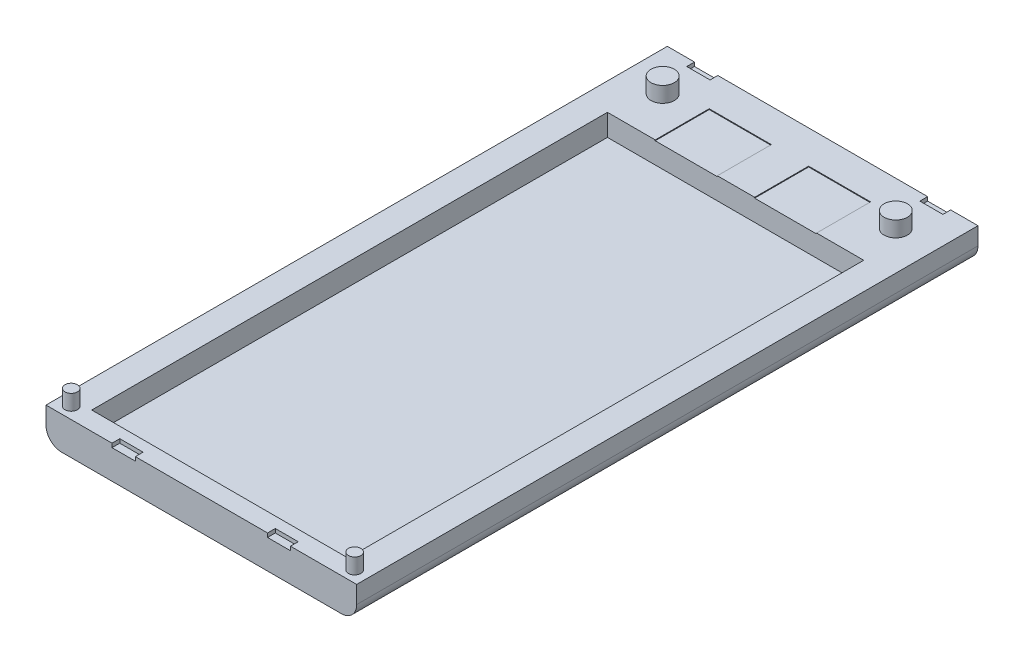
from build123d import *

# Parameters (mm, degrees)
SKETCH2_W           = 40
SKETCH2_H           = 80
BOSS_EXTRUDE2_DEPTH = 4.25
CUT_EXTRUDE3_DEPTH  = 2.8
CUT_EXTRUDE4_DEPTH  = 0.1
F_3DSKETCH4_R       = 1.5
BOSS_EXTRUDE3_DEPTH = 2
F_3DSKETCH5_R       = 0.8
BOSS_EXTRUDE4_DEPTH = 2
FILLET1_R           = 2
CUT_EXTRUDE5_DEPTH  = 1
SKETCH4_W           = 2.963043318
SKETCH4_H           = 0.5
SKETCH4_W_2         = 2.99871765
CUT_EXTRUDE6_DEPTH  = 1
SKETCH5_W           = 0.284935898
SKETCH5_H           = 3.256410256
SKETCH5_W_2         = 0.284935897
CUT_EXTRUDE7_DEPTH  = 0.5


with BuildPart() as part:
    # Sketch2 → Boss-Extrude2 (new body)
    with BuildSketch(Plane(origin=(0, 0, 0), x_dir=(1, 0, 0), z_dir=(0, 1, 0))):
        Rectangle(SKETCH2_W, SKETCH2_H)
    extrude(amount=BOSS_EXTRUDE2_DEPTH)

    # 3DSketch2 → Cut-Extrude3 (cut)
    with BuildSketch(Plane(origin=(-16.5, 4.25, 37.611644857), x_dir=(0.4450544542521407, 0, -0.8955035079497619), z_dir=(0, -1, 0))):
        Polygon((0, 0), (59.461432928, -29.551615762), (74.148229918, 0), (14.68679699, 29.551615762), align=None)
    extrude(amount=CUT_EXTRUDE3_DEPTH, mode=Mode.SUBTRACT)

    # 3DSketch3 → Cut-Extrude4 (cut)
    with BuildSketch(Plane(origin=(-2.347777477, 4.25, -28.788355143), x_dir=(0.8783770933066173, 0, -0.47796828551088866), z_dir=(0, 1, 0))):
        Polygon((0, 0), (-7.027782324, 3.824162873), (-3.705260259, 9.930064377), (3.322522065, 6.105901505), align=None)
        Polygon((4.216210048, -2.29424777), (11.221003942, -6.105901505), (14.543526007, 0), (7.538732113, 3.811653734), align=None)
    extrude(amount=-CUT_EXTRUDE4_DEPTH, mode=Mode.SUBTRACT)

    # 3DSketch4 → Boss-Extrude3 (add)
    with BuildSketch(Plane(origin=(-15, 4.25, -34.4), x_dir=(1, 0, 0), z_dir=(0, -1, 0))):
        with Locations(Location((0, 0, 0), (0, 0, 90))):
            Circle(F_3DSKETCH4_R)
        with Locations(Location((30.012966491, 0, 0), (0, 0, 90))):
            Circle(F_3DSKETCH4_R)
    extrude(amount=-BOSS_EXTRUDE3_DEPTH)

    # 3DSketch5 → Boss-Extrude4 (add)
    with BuildSketch(Plane(origin=(-18.25, 4.25, 38.508038117), x_dir=(1, 0, 0), z_dir=(0, -1, 0))):
        with Locations(Location((0, 0, 0), (0, 0, 90))):
            Circle(F_3DSKETCH5_R)
        with Locations(Location((36.500375839, 0, 0), (0, 0, 90))):
            Circle(F_3DSKETCH5_R)
    extrude(amount=-BOSS_EXTRUDE4_DEPTH)

    # Fillet1
    fillet1_edges = [part.edges().sort_by_distance(p)[0] for p in [
        (-20, 0, 0),
        (20, 0, 0),
    ]]
    fillet(fillet1_edges, radius=FILLET1_R)

    # 3DSketch6 → Cut-Extrude5 (cut)
    with BuildSketch(Plane(origin=(-11.502928921, 3.74686041, 40), x_dir=(0.9997603843672082, 0.021890039971004784, 0), z_dir=(0, 0, 1))):
        Polygon((0, 0), (3.005137591, -0.065798348), (3.016151337, 0.437220682), (0.011013746, 0.50301903), align=None)
        Polygon((20.021702774, -0.438380917), (22.973850192, -0.50301903), (22.984863938, 0), (20.032716519, 0.064638113), align=None)
    extrude(amount=-CUT_EXTRUDE5_DEPTH, mode=Mode.SUBTRACT)

    # Sketch4 → Cut-Extrude6 (cut)
    with BuildSketch(Plane(origin=(0, 0, -40), x_dir=(-1, 0, 0), z_dir=(0, 0, -1))):
        with Locations((-15, 4)):
            Rectangle(SKETCH4_W, SKETCH4_H)
        with Locations((15, 4)):
            Rectangle(SKETCH4_W_2, SKETCH4_H)
    extrude(amount=-CUT_EXTRUDE6_DEPTH, mode=Mode.SUBTRACT)

    # Sketch5 → Cut-Extrude7 (cut)
    # profile 1 of 9: a face of its own
    with BuildSketch(Plane(origin=(0, 0, 0), x_dir=(-1, 0, 0), z_dir=(0, -1, 0))):
        Polygon((-9.103165809, -33.30351631), (-8.797877348, -33.30351631), (-7.739544014, -35.80560966), (-6.681210681, -33.30351631), (-6.37592222, -33.30351631), (-7.71919145, -36.47851631), (-7.759896579, -36.47851631), align=None)
    # profile 2 of 9: a face of its own
    with BuildSketch(Plane(origin=(0, 0, 0), x_dir=(-1, 0, 0), z_dir=(0, -1, 0))):
        with BuildLine():
            add(Edge.make_bspline(
                [(-4.76679762, -34.117618875), (-4.72326268, -34.118545876), (-4.637901301, -34.120363499), (-4.512889862, -34.139789932), (-4.393559631, -34.16949647), (-4.279453586, -34.210564244), (-4.172033089, -34.265611442), (-4.069733461, -34.331297013), (-3.972835174, -34.40911408), (-3.91475714, -34.469310328), (-3.885277188, -34.499865469)],
                knots=[0, 0, 0, 0, 1.054011418, 2.066658804, 3.057071809, 4.030435133, 4.997543892, 5.974964718, 6.972108034, 8, 8, 8, 8], degree=3))
            add(Edge.make_bspline(
                [(-3.885277188, -34.499865469), (-3.859893558, -34.529088156), (-3.809617541, -34.586967991), (-3.745150782, -34.680817011), (-3.689614081, -34.778008388), (-3.645106967, -34.879832749), (-3.610014124, -34.985401201), (-3.585098814, -35.095076596), (-3.57027888, -35.208616726), (-3.568280474, -35.28572735), (-3.567268373, -35.324780333)],
                knots=[0, 0, 0, 0, 1.025258237, 2.030674902, 3.01204498, 3.988269485, 4.97094183, 5.956517959, 6.965070386, 8, 8, 8, 8], degree=3))
            add(Edge.make_bspline(
                [(-3.567268373, -35.324780333), (-3.568158587, -35.364059671), (-3.569917689, -35.441677475), (-3.58655797, -35.555995042), (-3.612439741, -35.666843203), (-3.649480051, -35.773757875), (-3.696976336, -35.877065868), (-3.754934317, -35.97631596), (-3.823760712, -36.071703966), (-3.901778624, -36.162419919), (-3.988004254, -36.246027843), (-4.081545331, -36.318897059), (-4.180563634, -36.381328013), (-4.286375818, -36.431616762), (-4.39801561, -36.471267704), (-4.515723807, -36.499117005), (-4.63931755, -36.515955103), (-4.723706529, -36.518117345), (-4.76679762, -36.519221439)],
                knots=[0, 0, 0, 0, 0.998656419, 1.973391657, 2.932242238, 3.890759089, 4.846373663, 5.82037756, 6.809684879, 7.83454468, 8.860553229, 9.859544525, 10.845671541, 11.83227036, 12.833544569, 13.85385346, 14.904124723, 16, 16, 16, 16], degree=3))
            add(Edge.make_bspline(
                [(-4.76679762, -36.519221439), (-4.81009983, -36.518113639), (-4.894909396, -36.515943958), (-5.018939394, -36.499182423), (-5.136858548, -36.471280539), (-5.248644491, -36.431486456), (-5.354911602, -36.381326406), (-5.454503639, -36.319085802), (-5.548120705, -36.246006232), (-5.634364576, -36.162425775), (-5.712377597, -36.071702458), (-5.781205254, -35.976316351), (-5.839162907, -35.877065766), (-5.886659278, -35.773757902), (-5.923699566, -35.666843196), (-5.949581342, -35.555995044), (-5.966221621, -35.441677474), (-5.967980724, -35.364059671), (-5.968870938, -35.324780333)],
                knots=[0, 0, 0, 0, 1.099876186, 2.154163076, 3.173186993, 4.173200201, 5.163417411, 6.152872554, 7.150605724, 8.17532212, 9.198891216, 10.186952605, 11.159729845, 12.11414092, 13.071450619, 14.029093627, 15.002601286, 16, 16, 16, 16], degree=3))
            add(Edge.make_bspline(
                [(-5.968870938, -35.324780333), (-5.967851935, -35.285939609), (-5.965834484, -35.209041651), (-5.951029451, -35.09571496), (-5.926211332, -34.986225186), (-5.891076422, -34.881064219), (-5.84615907, -34.779686073), (-5.791402759, -34.682254548), (-5.726278399, -34.5888299), (-5.676202343, -34.53102487), (-5.650862123, -34.501773522)],
                knots=[0, 0, 0, 0, 1.031353054, 2.041901799, 3.029428768, 4.008703097, 4.981709435, 5.96992636, 6.972712378, 8, 8, 8, 8], degree=3))
            add(Edge.make_bspline(
                [(-5.650862123, -34.501773522), (-5.621426616, -34.470953399), (-5.563536511, -34.410340203), (-5.466155879, -34.332749984), (-5.364107913, -34.265697546), (-5.255500301, -34.211744122), (-5.141487995, -34.169254895), (-5.021546253, -34.139713321), (-4.896110607, -34.120433492), (-4.810331522, -34.11856643), (-4.76679762, -34.117618875)],
                knots=[0, 0, 0, 0, 1.027980169, 2.021703884, 2.998553061, 3.971491411, 4.943284454, 5.930300938, 6.949603206, 8, 8, 8, 8], degree=3))
        make_face()
        with BuildLine():
            add(Edge.make_bspline(
                [(-4.768069656, -34.402554772), (-4.798855917, -34.403429794), (-4.859633698, -34.405157251), (-4.94909575, -34.418296221), (-5.035220033, -34.439112886), (-5.118169941, -34.468689423), (-5.197665748, -34.506879138), (-5.273783563, -34.553786008), (-5.346747276, -34.608788761), (-5.415129576, -34.671801327), (-5.477887817, -34.740634415), (-5.532749981, -34.813975427), (-5.579399899, -34.890634755), (-5.618262043, -34.970692118), (-5.647206421, -35.054958808), (-5.668227663, -35.142480523), (-5.681354238, -35.23343558), (-5.683065453, -35.29526736), (-5.68393504, -35.326688386)],
                knots=[0, 0, 0, 0, 1.021534396, 2.016698045, 2.994645724, 3.958388632, 4.93408049, 5.916473867, 6.921342795, 7.962252576, 8.998418191, 10.008913653, 10.997312074, 11.973003931, 12.956656626, 13.948281152, 14.957379055, 16, 16, 16, 16], degree=3))
            add(Edge.make_bspline(
                [(-5.68393504, -35.326688386), (-5.682477422, -35.367284868), (-5.679584321, -35.447861293), (-5.656057357, -35.566525668), (-5.616699803, -35.680446348), (-5.563552771, -35.788955498), (-5.496962844, -35.889351065), (-5.418506719, -35.978860197), (-5.329026419, -36.056135898), (-5.229588594, -36.120253522), (-5.12222432, -36.171198443), (-5.008598943, -36.207301799), (-4.89008917, -36.23077112), (-4.809098793, -36.233103815), (-4.768069656, -36.234285541)],
                knots=[0, 0, 0, 0, 1.016792936, 2.018143844, 3.017858371, 4.030088057, 5.03801393, 6.028138512, 7.003788237, 7.991172063, 8.984598303, 9.972568034, 10.972917682, 12, 12, 12, 12], degree=3))
            add(Edge.make_bspline(
                [(-4.768069656, -36.234285541), (-4.727042878, -36.23309693), (-4.646057159, -36.230750644), (-4.527712048, -36.20742), (-4.414397231, -36.171040251), (-4.307144472, -36.120310818), (-4.207751911, -36.055892413), (-4.117628065, -35.979296557), (-4.039841825, -35.889113991), (-3.973317769, -35.788822519), (-3.919300367, -35.680614571), (-3.880127034, -35.566504642), (-3.856543509, -35.447866647), (-3.853658043, -35.367286662), (-3.852204271, -35.326688386)],
                knots=[0, 0, 0, 0, 1.02726834, 2.027799167, 3.010890988, 4.004497153, 4.992059811, 5.971914811, 6.958719428, 7.966827853, 8.981595046, 9.981490638, 10.983022906, 12, 12, 12, 12], degree=3))
            add(Edge.make_bspline(
                [(-3.852204271, -35.326688386), (-3.853073559, -35.295267173), (-3.854784184, -35.233435022), (-3.867915045, -35.142482654), (-3.888920427, -35.054950991), (-3.917923252, -34.970720959), (-3.956616536, -34.890427473), (-4.004166055, -34.814200507), (-4.058804199, -34.740380354), (-4.122319731, -34.672023837), (-4.190630652, -34.608764197), (-4.263623937, -34.553764679), (-4.339628881, -34.507085289), (-4.418893739, -34.468362771), (-4.501854282, -34.439381969), (-4.587857892, -34.418176025), (-4.676938241, -34.405212775), (-4.73749823, -34.40344644), (-4.768069656, -34.402554772)],
                knots=[0, 0, 0, 0, 1.042956736, 2.052379634, 3.044323526, 4.02829302, 5.004299113, 5.996692471, 7.007513377, 8.048758398, 9.090003419, 10.095195979, 11.07790575, 12.047570684, 13.018257071, 13.989683339, 14.985167495, 16, 16, 16, 16], degree=3))
        make_face(mode=Mode.SUBTRACT)
    # profile 3 of 9: a face of its own
    with BuildSketch(Plane(origin=(0, 0, 0), x_dir=(-1, 0, 0), z_dir=(0, -1, 0))):
        with Locations((-2.895633758, -34.850311182)):
            Rectangle(SKETCH5_W, SKETCH5_H)
    # profile 4 of 9: a face of its own
    with BuildSketch(Plane(origin=(0, 0, 0), x_dir=(-1, 0, 0), z_dir=(0, -1, 0))):
        Polygon((-1.816947861, -33.222106054), (-1.532011963, -33.222106054), (-1.532011963, -34.158324003), (-1.124960681, -34.158324003), (-1.124960681, -34.4432599), (-1.532011963, -34.4432599), (-1.532011963, -36.47851631), (-1.816947861, -36.47851631), (-1.816947861, -34.4432599), (-2.223999143, -34.4432599), (-2.223999143, -34.158324003), (-1.816947861, -34.158324003), align=None)
    # profile 5 of 9: a face of its own
    with BuildSketch(Plane(origin=(0, 0, 0), x_dir=(-1, 0, 0), z_dir=(0, -1, 0))):
        with BuildLine():
            Line((1.724398293, -34.158324003), (1.724398293, -36.47851631))
            Line((1.724398293, -36.47851631), (1.439462396, -36.47851631))
            Line((1.439462396, -36.47851631), (1.439462396, -36.077189187))
            add(Edge.make_bspline(
                [(1.439462396, -36.077189187), (1.407332493, -36.113510819), (1.344630583, -36.18439294), (1.239908998, -36.276996053), (1.128903579, -36.353539245), (1.012153095, -36.415360954), (0.889762974, -36.461799462), (0.762004524, -36.494806907), (0.628825628, -36.516028457), (0.537882421, -36.518147563), (0.49179613, -36.519221439)],
                knots=[0, 0, 0, 0, 1.074387032, 2.096679803, 3.090159297, 4.057316773, 5.018401886, 5.985159533, 6.978961417, 8, 8, 8, 8], degree=3))
            add(Edge.make_bspline(
                [(0.49179613, -36.519221439), (0.450822343, -36.518108944), (0.370020221, -36.515915055), (0.25115813, -36.498894965), (0.136774447, -36.471562187), (0.026761084, -36.433552094), (-0.078170076, -36.383132349), (-0.17891745, -36.322769931), (-0.274959106, -36.250887178), (-0.364831145, -36.168710895), (-0.447591602, -36.079452585), (-0.520218614, -35.984251982), (-0.580773194, -35.883520749), (-0.631409981, -35.778534245), (-0.670413808, -35.668484283), (-0.697604176, -35.553751423), (-0.714604438, -35.434471324), (-0.716797421, -35.353246185), (-0.717909399, -35.31205998)],
                knots=[0, 0, 0, 0, 1.033919861, 2.038935746, 3.024066025, 3.998881131, 4.97069526, 5.957263378, 6.95902576, 7.993208707, 9.027059324, 10.027763471, 11.009749337, 11.988697705, 12.965288445, 13.950418724, 14.960734635, 16, 16, 16, 16], degree=3))
            add(Edge.make_bspline(
                [(-0.717909399, -35.31205998), (-0.716772775, -35.271725049), (-0.714525731, -35.191985066), (-0.697786024, -35.074710819), (-0.669636466, -34.961754968), (-0.630132347, -34.85348117), (-0.579475717, -34.74975841), (-0.517855238, -34.65051333), (-0.44526646, -34.555472519), (-0.361580348, -34.466870764), (-0.270925235, -34.385027778), (-0.173943744, -34.313899572), (-0.073048339, -34.252470717), (0.033325964, -34.203799349), (0.143604695, -34.16442109), (0.258769606, -34.137176897), (0.378341538, -34.121122899), (0.459522199, -34.118798105), (0.500700377, -34.117618875)],
                knots=[0, 0, 0, 0, 1.020392517, 2.01726096, 2.990465484, 3.961182959, 4.928053699, 5.906110375, 6.912531644, 7.948652711, 8.985773172, 9.998621852, 10.987621588, 11.969261332, 12.953316658, 13.946091881, 14.958173133, 16, 16, 16, 16], degree=3))
            add(Edge.make_bspline(
                [(0.500700377, -34.117618875), (0.548053106, -34.118923121), (0.640909573, -34.121480686), (0.776734267, -34.142764731), (0.905226044, -34.178722483), (1.027376777, -34.227633357), (1.142747828, -34.292628989), (1.250246964, -34.374616525), (1.350999224, -34.473078888), (1.409401346, -34.548707791), (1.439462396, -34.587635902)],
                knots=[0, 0, 0, 0, 1.038897134, 2.037228247, 3.008116434, 3.962042015, 4.918381754, 5.904844433, 6.921570401, 8, 8, 8, 8], degree=3))
            Line((1.439462396, -34.587635902), (1.439462396, -34.158324003))
            Line((1.439462396, -34.158324003), (1.724398293, -34.158324003))
        make_face()
        with BuildLine():
            add(Edge.make_bspline(
                [(0.504516482, -34.402554772), (0.462865619, -34.404036715), (0.380653439, -34.406961834), (0.259963523, -34.42979779), (0.144472068, -34.467793101), (0.034756701, -34.519755969), (-0.067449467, -34.585096323), (-0.158793011, -34.664127863), (-0.240021033, -34.754694297), (-0.308336387, -34.856386926), (-0.364026338, -34.965405623), (-0.403185003, -35.079364935), (-0.429010677, -35.19620945), (-0.431649121, -35.275459886), (-0.432973502, -35.315240068)],
                knots=[0, 0, 0, 0, 1.031046209, 2.035121221, 3.029706178, 4.034933723, 5.034054252, 6.02443088, 7.017295772, 8.038157696, 9.050218397, 10.03989886, 11.016116709, 12, 12, 12, 12], degree=3))
            add(Edge.make_bspline(
                [(-0.432973502, -35.315240068), (-0.431281777, -35.354782523), (-0.427904959, -35.433712438), (-0.403638257, -35.550716247), (-0.362925801, -35.664702414), (-0.307370501, -35.774703458), (-0.237804777, -35.876833321), (-0.157170071, -35.969126146), (-0.064686601, -36.048491701), (0.03775478, -36.114928643), (0.147163439, -36.168597501), (0.262219934, -36.205940617), (0.380761406, -36.230050461), (0.461363166, -36.232866665), (0.501972412, -36.234285541)],
                knots=[0, 0, 0, 0, 0.979072187, 1.954306742, 2.945804271, 3.96968567, 4.997920485, 5.998718438, 6.996577872, 8.005894225, 9.015743152, 10.005417472, 10.995077863, 12, 12, 12, 12], degree=3))
            add(Edge.make_bspline(
                [(0.501972412, -36.234285541), (0.543198882, -36.232779717), (0.625194243, -36.229784781), (0.746242213, -36.206851062), (0.863712644, -36.168960795), (0.976005344, -36.116438016), (1.080613549, -36.051343843), (1.174500909, -35.97513741), (1.253890395, -35.886506665), (1.321193691, -35.789100882), (1.373967104, -35.682319286), (1.412408244, -35.56862327), (1.435135715, -35.448008877), (1.438000227, -35.365582314), (1.439462396, -35.323508298)],
                knots=[0, 0, 0, 0, 1.01762866, 2.023962475, 3.030623092, 4.058876274, 5.077231937, 6.066672613, 7.034107872, 8.005628644, 8.981990164, 9.965428785, 10.961468474, 12, 12, 12, 12], degree=3))
            add(Edge.make_bspline(
                [(1.439462396, -35.323508298), (1.43859185, -35.291451837), (1.436878341, -35.228354578), (1.423787753, -35.13571033), (1.402964356, -35.047051879), (1.373621759, -34.962286011), (1.335076094, -34.88188139), (1.288587049, -34.805260693), (1.233337105, -34.732822423), (1.170215659, -34.665564065), (1.10112294, -34.604217203), (1.028012178, -34.549458213), (0.950017172, -34.504474112), (0.868449574, -34.467243816), (0.783167864, -34.437617302), (0.693478087, -34.417852751), (0.600333577, -34.404281602), (0.536791799, -34.403136443), (0.504516482, -34.402554772)],
                knots=[0, 0, 0, 0, 1.050140795, 2.067009409, 3.05949893, 4.030605086, 5.00011959, 5.97591094, 6.962425594, 7.979863591, 8.993523472, 9.986985069, 10.967611495, 11.937549037, 12.921786183, 13.919465291, 14.943216303, 16, 16, 16, 16], degree=3))
        make_face(mode=Mode.SUBTRACT)
    # profile 6 of 9: a face of its own
    with BuildSketch(Plane(origin=(0, 0, 0), x_dir=(-1, 0, 0), z_dir=(0, -1, 0))):
        with BuildLine():
            Line((6.609013678, -33.886108458), (6.359694768, -34.076913746))
            add(Edge.make_bspline(
                [(6.359694768, -34.076913746), (6.341909426, -34.055717474), (6.306578528, -34.0136107), (6.24973768, -33.954483542), (6.190499761, -33.899088626), (6.128887415, -33.847162064), (6.063791643, -33.800519712), (5.996789347, -33.756730926), (5.926759691, -33.717480907), (5.829920618, -33.669889483), (5.70324007, -33.6202269), (5.543769037, -33.578586112), (5.377298255, -33.552078331), (5.263726147, -33.549207367), (5.20595879, -33.54774708)],
                knots=[0, 0, 0, 0, 0.757959112, 1.505699292, 2.245454638, 2.979532153, 3.711538275, 4.438200793, 5.171680507, 5.909471876, 7.393775596, 8.890124382, 10.418191784, 12, 12, 12, 12], degree=3))
            add(Edge.make_bspline(
                [(5.20595879, -33.54774708), (5.174133226, -33.548113531), (5.110777468, -33.548843034), (5.016753496, -33.558467026), (4.924485228, -33.571993624), (4.834032683, -33.592064453), (4.745511, -33.617439614), (4.658341464, -33.64776124), (4.573786134, -33.685275987), (4.490675303, -33.726739909), (4.411047019, -33.773573376), (4.335704226, -33.824657631), (4.264921712, -33.879421026), (4.198643485, -33.938068815), (4.136801789, -34.00033688), (4.079844729, -34.066888818), (4.027969392, -34.137511861), (3.98014752, -34.211274738), (3.937318826, -34.287962592), (3.901459578, -34.367859263), (3.869704931, -34.449596556), (3.844577761, -34.534097966), (3.824689092, -34.620768904), (3.810966141, -34.709841976), (3.801451599, -34.8011311), (3.800725724, -34.86300669), (3.800359832, -34.894196399)],
                knots=[0, 0, 0, 0, 1.054917814, 2.100044995, 3.131103042, 4.146048494, 5.169673617, 6.183595914, 7.203665975, 8.234915748, 9.262203917, 10.264457458, 11.251630812, 12.227803204, 13.197192746, 14.159520551, 15.12972552, 16.100847026, 17.073214652, 18.039054194, 19.002613845, 19.979014051, 20.95965708, 21.949030935, 22.966165397, 24, 24, 24, 24], degree=3))
            add(Edge.make_bspline(
                [(3.800359832, -34.894196399), (3.801504482, -34.941124096), (3.80375185, -35.033260405), (3.823752839, -35.168216602), (3.854146743, -35.297503213), (3.899699445, -35.42031207), (3.95586887, -35.538157509), (4.026844282, -35.649045612), (4.109046426, -35.754652067), (4.203638221, -35.852481026), (4.30742064, -35.941847049), (4.418770531, -36.020542219), (4.537410564, -36.086142148), (4.662030792, -36.140730328), (4.793590196, -36.182691788), (4.931852195, -36.2122321), (5.076516076, -36.231501793), (5.175366889, -36.233346638), (5.225675336, -36.234285541)],
                knots=[0, 0, 0, 0, 1.029171465, 2.020641659, 2.987623507, 3.938342917, 4.889210282, 5.84687017, 6.821220943, 7.821438502, 8.827599549, 9.822697543, 10.807740252, 11.797342354, 12.80366471, 13.83203677, 14.896651826, 16, 16, 16, 16], degree=3))
            add(Edge.make_bspline(
                [(5.225675336, -36.234285541), (5.281104204, -36.232753577), (5.390201476, -36.229738304), (5.550192471, -36.204193842), (5.70335063, -36.162775588), (5.849684191, -36.104811045), (5.98878062, -36.029458962), (6.12085759, -35.938111602), (6.246026586, -35.829900043), (6.321293392, -35.747274634), (6.359694768, -35.705118875)],
                knots=[0, 0, 0, 0, 1.028121516, 2.023589091, 2.998037872, 3.967518031, 4.937445131, 5.927275754, 6.942489185, 8, 8, 8, 8], degree=3))
            Line((6.359694768, -35.705118875), (6.609013678, -35.89401611))
            add(Edge.make_bspline(
                [(6.609013678, -35.89401611), (6.588949392, -35.919904563), (6.548916928, -35.971557464), (6.484094299, -36.044375372), (6.415807036, -36.112868319), (6.343547928, -36.17648409), (6.268148217, -36.236495641), (6.188254048, -36.291198016), (6.104915711, -36.341354747), (6.018415577, -36.3872806), (5.928845549, -36.42802696), (5.836312955, -36.46291002), (5.741216647, -36.492959027), (5.643552279, -36.517680427), (5.543117271, -36.536976339), (5.440274055, -36.549875615), (5.334800668, -36.558712923), (5.263643093, -36.55951839), (5.227583389, -36.559926567)],
                knots=[0, 0, 0, 0, 0.986787822, 1.968848986, 2.935600012, 3.899624008, 4.868462664, 5.837806735, 6.815139263, 7.798259679, 8.787526145, 9.778297419, 10.776456485, 11.791383307, 12.812564526, 13.85620153, 14.913611965, 16, 16, 16, 16], degree=3))
            add(Edge.make_bspline(
                [(5.227583389, -36.559926567), (5.193435206, -36.559688902), (5.125911401, -36.55921895), (5.026217534, -36.551606055), (4.9291627, -36.541219508), (4.835024289, -36.525580246), (4.743288583, -36.507125023), (4.654787196, -36.482386098), (4.568649255, -36.454673639), (4.485220831, -36.422102687), (4.404430961, -36.385348722), (4.326540218, -36.343809236), (4.251584426, -36.297833545), (4.178826651, -36.248435071), (4.1093417, -36.19402709), (4.042527431, -36.135365214), (3.978009184, -36.072647162), (3.938092463, -36.027421688), (3.918023093, -36.004683177)],
                knots=[0, 0, 0, 0, 1.114604814, 2.203992996, 3.262667896, 4.300477797, 5.318619304, 6.316056647, 7.298880507, 8.271930387, 9.238335007, 10.195173496, 11.151986948, 12.108099108, 13.064862484, 14.031167946, 15.010108607, 16, 16, 16, 16], degree=3))
            add(Edge.make_bspline(
                [(3.918023093, -36.004683177), (3.885877902, -35.965185099), (3.821975605, -35.886665797), (3.740218735, -35.759406371), (3.670234881, -35.626538782), (3.61365101, -35.487364989), (3.569416245, -35.342197288), (3.538771876, -35.1909625), (3.518858634, -35.033801867), (3.516581444, -34.926907066), (3.515423934, -34.872571799)],
                knots=[0, 0, 0, 0, 0.994628077, 1.977248131, 2.950237994, 3.925870899, 4.908910175, 5.911660606, 6.938484602, 8, 8, 8, 8], degree=3))
            add(Edge.make_bspline(
                [(3.515423934, -34.872571799), (3.516834717, -34.815462209), (3.519610344, -34.703102656), (3.543192244, -34.538207713), (3.581127866, -34.380227515), (3.63500933, -34.229456976), (3.703322041, -34.085103079), (3.787710469, -33.948268557), (3.887194234, -33.818078317), (4.000993099, -33.696507793), (4.125786325, -33.585347094), (4.259425534, -33.487551467), (4.401649158, -33.406164863), (4.550890352, -33.33813263), (4.708266649, -33.285840867), (4.873442276, -33.249234762), (5.046106863, -33.226449949), (5.163910635, -33.223569582), (5.223767284, -33.222106054)],
                knots=[0, 0, 0, 0, 1.032925535, 2.032216505, 3.007276963, 3.968222605, 4.92396291, 5.891752235, 6.871517503, 7.883894988, 8.900124299, 9.891468569, 10.874487609, 11.85992873, 12.854644235, 13.869047385, 14.917252991, 16, 16, 16, 16], degree=3))
            add(Edge.make_bspline(
                [(5.223767284, -33.222106054), (5.260247555, -33.222543422), (5.332456577, -33.223409149), (5.439275055, -33.231851149), (5.543272023, -33.245924206), (5.644519128, -33.265079498), (5.74350893, -33.288853282), (5.839484862, -33.31982341), (5.9330101, -33.355235121), (6.023494795, -33.396018872), (6.110504808, -33.441799416), (6.19401304, -33.492069303), (6.273356162, -33.546766212), (6.349092475, -33.60542495), (6.419955037, -33.6692865), (6.487955807, -33.736594319), (6.5507855, -33.809287146), (6.589568755, -33.860454478), (6.609013678, -33.886108458)],
                knots=[0, 0, 0, 0, 1.096760587, 2.17092713, 3.219439832, 4.250915756, 5.268269357, 6.278326846, 7.281116186, 8.274029601, 9.260640565, 10.235837813, 11.203064059, 12.156899882, 13.114053108, 14.069676657, 15.032185724, 16, 16, 16, 16], degree=3))
        make_face()
    # profile 7 of 9: a face of its own
    with BuildSketch(Plane(origin=(0, 0, 0), x_dir=(-1, 0, 0), z_dir=(0, -1, 0))):
        with BuildLine():
            Line((9.083122252, -35.745824003), (9.336257268, -35.878751687))
            add(Edge.make_bspline(
                [(9.336257268, -35.878751687), (9.316085499, -35.914532423), (9.276839226, -35.984147567), (9.209347119, -36.079789326), (9.138597167, -36.165829754), (9.06139571, -36.239970226), (8.980052502, -36.304605411), (8.89411645, -36.361154723), (8.803140166, -36.409340809), (8.707119344, -36.449937745), (8.605247608, -36.481152072), (8.49727809, -36.503199473), (8.383003948, -36.516827723), (8.304675627, -36.518410815), (8.264567564, -36.519221439)],
                knots=[0, 0, 0, 0, 1.120438281, 2.179929193, 3.190490725, 4.156257408, 5.095198341, 6.022838206, 6.959905092, 7.901321166, 8.864066838, 9.862729781, 10.905609505, 12, 12, 12, 12], degree=3))
            add(Edge.make_bspline(
                [(8.264567564, -36.519221439), (8.21998877, -36.518180787), (8.133028458, -36.516150776), (8.006445973, -36.498649755), (7.887266072, -36.47009983), (7.775495455, -36.430216803), (7.67140784, -36.378122016), (7.574796351, -36.314658772), (7.485152924, -36.240153083), (7.405302391, -36.153959595), (7.333416869, -36.061719534), (7.269984161, -35.96560241), (7.21695492, -35.865850057), (7.173817909, -35.76309751), (7.13897921, -35.657992407), (7.114697986, -35.549578432), (7.100701, -35.43814901), (7.09855611, -35.362767855), (7.097475216, -35.324780333)],
                knots=[0, 0, 0, 0, 1.145258523, 2.234067595, 3.276747158, 4.290159414, 5.277019952, 6.260822364, 7.254936242, 8.264827045, 9.274100331, 10.257902744, 11.220704747, 12.172965371, 13.118907548, 14.062713208, 15.023725156, 16, 16, 16, 16], degree=3))
            add(Edge.make_bspline(
                [(7.097475216, -35.324780333), (7.098436009, -35.289134308), (7.100340173, -35.218488594), (7.112342387, -35.113926279), (7.133613338, -35.012300469), (7.162801861, -34.913526719), (7.200494777, -34.817770412), (7.246606862, -34.724973269), (7.301209947, -34.635234035), (7.343367301, -34.578625478), (7.36460262, -34.550110862)],
                knots=[0, 0, 0, 0, 1.024358464, 2.0301432, 3.019427413, 4.004406732, 4.986367066, 5.972626655, 6.978780325, 8, 8, 8, 8], degree=3))
            add(Edge.make_bspline(
                [(7.36460262, -34.550110862), (7.393366018, -34.515758387), (7.449981662, -34.448141636), (7.545736356, -34.359297583), (7.649422963, -34.284872159), (7.759742081, -34.223179971), (7.877975882, -34.176304591), (8.002535025, -34.141372713), (8.134837807, -34.121798374), (8.225284686, -34.119033554), (8.271563758, -34.117618875)],
                knots=[0, 0, 0, 0, 1.030682036, 2.02871468, 2.997146059, 3.962720338, 4.930598197, 5.918074684, 6.934738563, 8, 8, 8, 8], degree=3))
            add(Edge.make_bspline(
                [(8.271563758, -34.117618875), (8.319141228, -34.11884719), (8.41247738, -34.121256866), (8.548577947, -34.143596468), (8.677356597, -34.179022714), (8.798761797, -34.229055081), (8.912805857, -34.29360696), (9.018747488, -34.373564202), (9.118398502, -34.466472039), (9.176372713, -34.537921521), (9.205873654, -34.574279532)],
                knots=[0, 0, 0, 0, 1.056321875, 2.072262726, 3.055038591, 4.01806755, 4.982017516, 5.957941055, 6.960871419, 8, 8, 8, 8], degree=3))
            add(Edge.make_bspline(
                [(9.205873654, -34.574279532), (9.225945948, -34.601678495), (9.265956929, -34.656294045), (9.316073941, -34.745349309), (9.359578149, -34.838522491), (9.394351621, -34.937319689), (9.422508883, -35.040570308), (9.442880425, -35.149012474), (9.454827151, -35.262613894), (9.457175469, -35.340017269), (9.458372652, -35.379477849)],
                knots=[0, 0, 0, 0, 0.94817472, 1.890038105, 2.849395472, 3.817997239, 4.812318967, 5.836947057, 6.897266129, 8, 8, 8, 8], degree=3))
            Line((9.458372652, -35.379477849), (7.382411114, -35.379477849))
            add(Edge.make_bspline(
                [(7.382411114, -35.379477849), (7.383807757, -35.410048984), (7.386554199, -35.470165889), (7.39935865, -35.558132242), (7.419541466, -35.64192806), (7.447906973, -35.720924819), (7.482257611, -35.796154292), (7.524336083, -35.867058426), (7.574536964, -35.933314262), (7.630530991, -35.995514451), (7.692858142, -36.050905285), (7.75842892, -36.100482253), (7.828182368, -36.142034473), (7.901568487, -36.175761945), (7.978468606, -36.202165531), (8.058906955, -36.220188483), (8.142725246, -36.23225993), (8.199862305, -36.233602198), (8.228950577, -36.234285541)],
                knots=[0, 0, 0, 0, 1.094153842, 2.151609401, 3.174256925, 4.172055639, 5.149267565, 6.128595816, 7.11444997, 8.118368179, 9.117203808, 10.09244225, 11.054858984, 12.015122123, 12.976791628, 13.957293641, 14.960065497, 16, 16, 16, 16], degree=3))
            add(Edge.make_bspline(
                [(8.228950577, -36.234285541), (8.257390546, -36.233733947), (8.313820902, -36.232639478), (8.397859394, -36.221996959), (8.480535965, -36.204788209), (8.561508428, -36.181302289), (8.63913341, -36.152657574), (8.711020445, -36.118092838), (8.777133212, -36.079856997), (8.838925032, -36.036123934), (8.898860861, -35.982595079), (8.95831726, -35.915796961), (9.022068224, -35.836796132), (9.061973069, -35.777336849), (9.083122252, -35.745824003)],
                knots=[0, 0, 0, 0, 0.99110716, 1.966546729, 2.947904876, 3.932708344, 4.903319531, 5.828989031, 6.710028674, 7.56322171, 8.463672341, 9.504779593, 10.677557249, 12, 12, 12, 12], degree=3))
        make_face()
        with BuildLine():
            add(Edge.make_bspline(
                [(9.173436755, -35.094541951), (9.163007674, -35.056747773), (9.14293505, -34.984006146), (9.100992063, -34.883276195), (9.053755736, -34.793752171), (8.997856023, -34.716119218), (8.934520465, -34.647173174), (8.861363763, -34.586922029), (8.779325489, -34.533021913), (8.688829697, -34.487526431), (8.592997506, -34.448800631), (8.492661889, -34.422833561), (8.390283753, -34.405044905), (8.32103765, -34.403388364), (8.286192163, -34.402554772)],
                knots=[0, 0, 0, 0, 1.154881502, 2.222775134, 3.210006277, 4.132804581, 5.035138423, 5.962687519, 6.919655026, 7.923214229, 8.944639381, 9.960483929, 10.97369054, 12, 12, 12, 12], degree=3))
            add(Edge.make_bspline(
                [(8.286192163, -34.402554772), (8.257753744, -34.403109645), (8.201536968, -34.404206514), (8.118713856, -34.41461156), (8.039175844, -34.431810847), (7.962336047, -34.455364772), (7.889201402, -34.486759719), (7.818267577, -34.523574503), (7.751338217, -34.568515797), (7.709481471, -34.602768472), (7.688335593, -34.620072801)],
                knots=[0, 0, 0, 0, 1.04873581, 2.073130211, 3.073294108, 4.04793562, 5.032784715, 6.005352987, 6.992311501, 8, 8, 8, 8], degree=3))
            add(Edge.make_bspline(
                [(7.688335593, -34.620072801), (7.673192401, -34.633765501), (7.642546272, -34.66147619), (7.601597371, -34.709218399), (7.562390228, -34.760700173), (7.526708986, -34.817891108), (7.493981461, -34.880139957), (7.463356339, -34.946921669), (7.435791522, -35.018743009), (7.420282908, -35.068792293), (7.412303942, -35.094541951)],
                knots=[0, 0, 0, 0, 0.879870761, 1.780643979, 2.707998968, 3.669668524, 4.684282772, 5.740141944, 6.837334558, 8, 8, 8, 8], degree=3))
            Line((7.412303942, -35.094541951), (9.173436755, -35.094541951))
        make_face(mode=Mode.SUBTRACT)
    # profile 8 of 9: a face of its own
    with BuildSketch(Plane(origin=(0, 0, 0), x_dir=(-1, 0, 0), z_dir=(0, -1, 0))):
        with Locations((10.130007268, -34.850311182)):
            Rectangle(SKETCH5_W_2, SKETCH5_H)
    # profile 9 of 9: a face of its own
    with BuildSketch(Plane(origin=(0, 0, 0), x_dir=(-1, 0, 0), z_dir=(0, -1, 0))):
        with Locations((11.025520088, -34.850311182)):
            Rectangle(SKETCH5_W, SKETCH5_H)
    extrude(amount=-CUT_EXTRUDE7_DEPTH, mode=Mode.SUBTRACT)


solid = part.part
